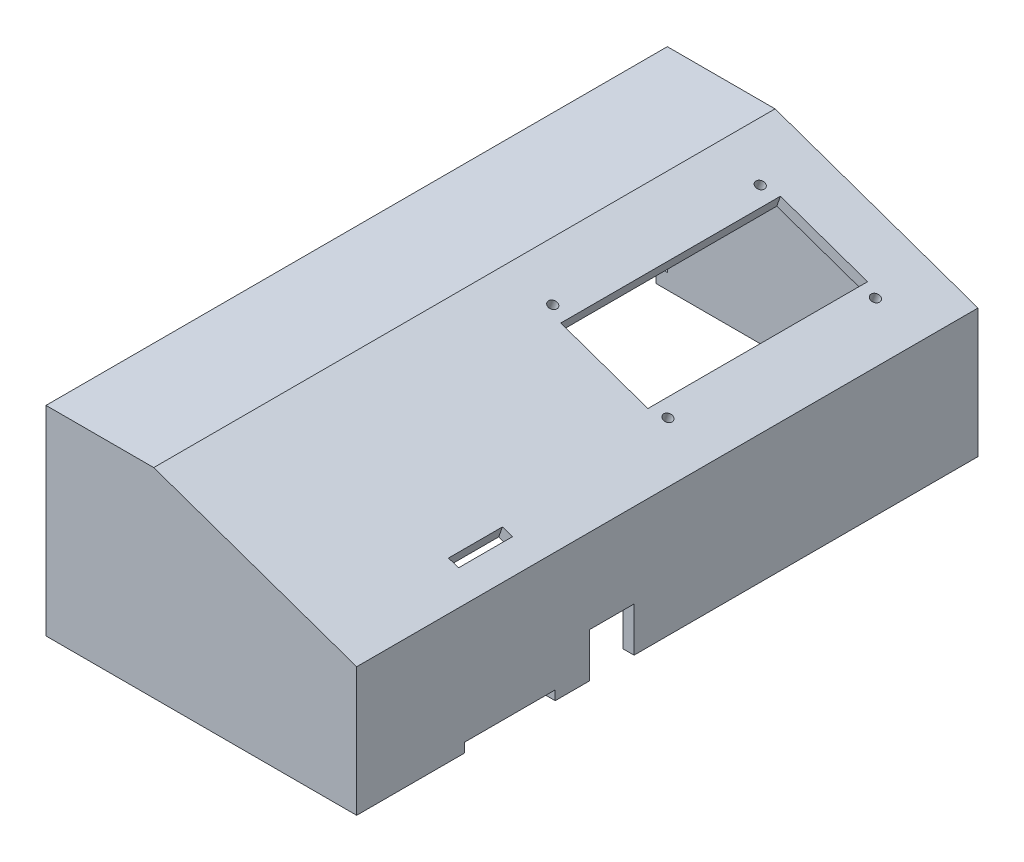
from build123d import *

# Parameters (mm, degrees)
BOSS_EXTRUDE1_DEPTH = 280
CUT_EXTRUDE1_DEPTH  = 270
SKETCH3_W           = 270
SKETCH3_H           = 85
CUT_EXTRUDE2_DEPTH  = 10
SKETCH5_W           = 20
SKETCH5_H           = 20
CUT_EXTRUDE3_DEPTH  = 10
SKETCH6_W           = 20
SKETCH6_H           = 40
CUT_EXTRUDE4_DEPTH  = 10
SKETCH7_W           = 40.827285369
SKETCH7_H           = 8.467009586
CUT_EXTRUDE5_DEPTH  = 10
SKETCH8_W           = 10
SKETCH8_H           = 8.095282404
CUT_EXTRUDE6_DEPTH  = 10
SKETCH9_W           = 41.6
SKETCH9_H           = 99
CUT_EXTRUDE7_DEPTH  = 10
SKETCH10_R          = 2
CUT_EXTRUDE8_DEPTH  = 10
SKETCH11_W          = 4.769310571
SKETCH11_H          = 24.293595375
CUT_EXTRUDE9_DEPTH  = 10


with BuildPart() as part:
    # Sketch1 → Boss-Extrude1 (new body)
    with BuildSketch(Plane.XY):
        Polygon((0, 0), (0, 90), (48.55, 90), (140, 58), (140, 0), align=None)
    extrude(amount=BOSS_EXTRUDE1_DEPTH)

    # Sketch2 → Cut-Extrude1 (cut)
    with BuildSketch(Plane.XY.offset(275)):
        Polygon((47.700459291, 85), (5, 85), (5, 0), (135, 0), (135, 54.452320364), align=None)
    extrude(amount=-CUT_EXTRUDE1_DEPTH, mode=Mode.SUBTRACT)

    # Sketch3 → Cut-Extrude2 (cut)
    with BuildSketch(Plane.ZY):
        with Locations((140, 42.5)):
            Rectangle(SKETCH3_W, SKETCH3_H)
    extrude(amount=-CUT_EXTRUDE2_DEPTH, mode=Mode.SUBTRACT)

    # Sketch5 → Cut-Extrude3 (cut)
    with BuildSketch(Plane(origin=(0, 0, 0), x_dir=(-1, 0, 0), z_dir=(0, 0, -1))):
        with Locations((-114, 10)):
            Rectangle(SKETCH5_W, SKETCH5_H)
    extrude(amount=-CUT_EXTRUDE3_DEPTH, mode=Mode.SUBTRACT)

    # Sketch6 → Cut-Extrude4 (cut)
    with BuildSketch(Plane(origin=(140, 0, 0), x_dir=(0, 0, -1), z_dir=(1, 0, 0))):
        with Locations((-165, 0)):
            Rectangle(SKETCH6_W, SKETCH6_H)
    extrude(amount=-CUT_EXTRUDE4_DEPTH, mode=Mode.SUBTRACT)

    # Sketch7 → Cut-Extrude5 (cut)
    with BuildSketch(Plane(origin=(140, 0, 0), x_dir=(0, 0, -1), z_dir=(1, 0, 0))):
        with Locations((-210.948744131, 0)):
            Rectangle(SKETCH7_W, SKETCH7_H)
    extrude(amount=-CUT_EXTRUDE5_DEPTH, mode=Mode.SUBTRACT)

    # Sketch8 → Cut-Extrude6 (cut)
    with BuildSketch(Plane(origin=(0, 0, 0), x_dir=(-1, 0, 0), z_dir=(0, 0, -1))):
        with Locations((0, 70.952358798)):
            Rectangle(SKETCH8_W, SKETCH8_H)
        with Locations((0, 40.952358798)):
            Rectangle(SKETCH8_W, SKETCH8_H)
        with Locations((0, 10.952358798)):
            Rectangle(SKETCH8_W, SKETCH8_H)
    extrude(amount=-CUT_EXTRUDE6_DEPTH, mode=Mode.SUBTRACT)

    # Sketch9 → Cut-Extrude7 (cut)
    with BuildSketch(Plane(origin=(33.353337731, 95.317585485, 0), x_dir=(0.9438824905069991, -0.3302814619598029, 0), z_dir=(0.3302814619598029, 0.9438824905069991, 0))):
        with Locations((64.602992172, -73.228951903)):
            Rectangle(SKETCH9_W, SKETCH9_H)
    extrude(amount=-CUT_EXTRUDE7_DEPTH, mode=Mode.SUBTRACT)

    # Sketch10 → Cut-Extrude8 (cut)
    with BuildSketch(Plane(origin=(31.701930421, 90.598173032, 0), x_dir=(0.9438824905069991, -0.330281461959803, 0), z_dir=(-0.330281461959803, -0.9438824905069991, 0))):
        with Locations((91.802992172, 26.228951903)):
            Circle(SKETCH10_R)
        with Locations((36.802992172, 26.228951903)):
            Circle(SKETCH10_R)
        with Locations((91.802992172, 119.728951903)):
            Circle(SKETCH10_R)
        with Locations((36.802992172, 119.728951903)):
            Circle(SKETCH10_R)
    extrude(amount=-CUT_EXTRUDE8_DEPTH, mode=Mode.SUBTRACT)

    # Sketch11 → Cut-Extrude9 (cut)
    with BuildSketch(Plane(origin=(33.353337731, 95.317585485, 0), x_dir=(0.9438824905069991, -0.3302814619598029, 0), z_dir=(0.3302814619598029, 0.9438824905069991, 0))):
        with Locations((98.320616835, -210.37484194)):
            Rectangle(SKETCH11_W, SKETCH11_H)
    extrude(amount=-CUT_EXTRUDE9_DEPTH, mode=Mode.SUBTRACT)


solid = part.part
